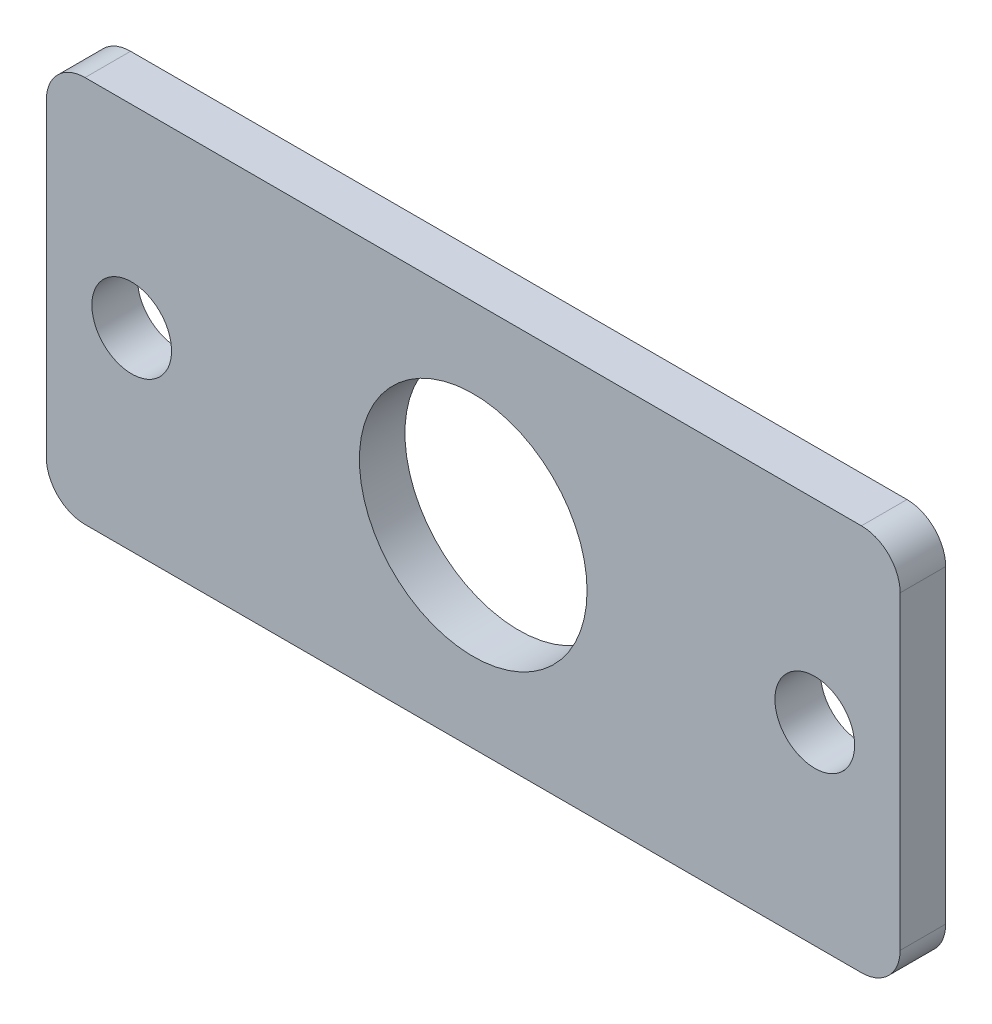
from build123d import *

# Parameters (mm, degrees)
SKETCH_3_W           = 75
SKETCH_3_H           = 34
EXTRUDE_1_DEPTH      = 4
SKETCH_6_R           = 10
CUT_EXTRUDE_2_DEPTH  = 42.367257584
FILLET_1_R           = 3.4
SKETCH_4_R           = 3.5
CUT_EXTRUDE_20_DEPTH = 42.367257584


with BuildPart() as part:
    # 草图3 → 凸台-拉伸1 (new body)
    with BuildSketch(Plane.XY):
        Rectangle(SKETCH_3_W, SKETCH_3_H)
    extrude(amount=EXTRUDE_1_DEPTH)

    # 草图6 → 切除-拉伸2 (cut, through all)
    with BuildSketch(Plane.XY.offset(4)):
        Circle(SKETCH_6_R)
    extrude(amount=-CUT_EXTRUDE_2_DEPTH, mode=Mode.SUBTRACT)

    # 圆角1
    fillet_1_edges = [part.edges().sort_by_distance(p)[0] for p in [
        (37.5, -17, 2),
        (-37.5, -17, 2),
        (-37.5, 17, 2),
        (37.5, 17, 2),
    ]]
    fillet(fillet_1_edges, radius=FILLET_1_R)

    # 草图4 → 20 (cut, through all)
    with BuildSketch(Plane.XY.offset(4)):
        with Locations((30, 0)):
            Circle(SKETCH_4_R)
        with Locations(Location((-30, 0, 0), (0, 0, 180))):
            Circle(SKETCH_4_R)
    extrude(amount=-CUT_EXTRUDE_20_DEPTH, mode=Mode.SUBTRACT)


solid = part.part
